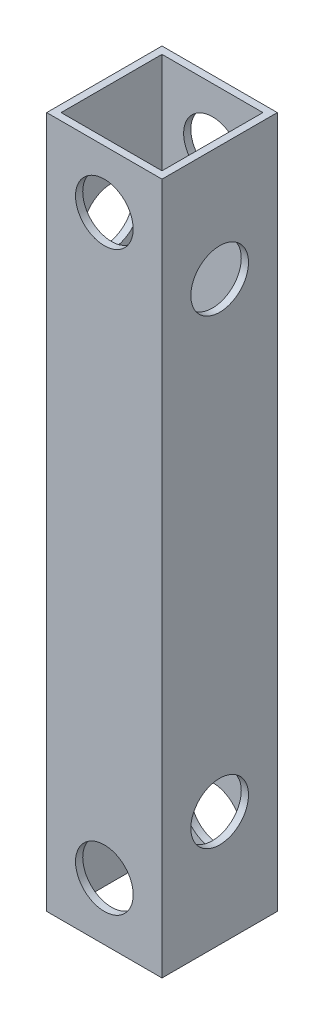
from build123d import *

# Parameters (mm, degrees)
SKETCH1_W           = 25.4
SKETCH1_H           = 25.4
SKETCH1_W_2         = 22.225
SKETCH1_H_2         = 22.225
BOSS_EXTRUDE1_DEPTH = 152.4
SKETCH2_R           = 6.35
CUT_EXTRUDE1_DEPTH  = 127
SKETCH3_R           = 6.35
CUT_EXTRUDE2_DEPTH  = 127
SKETCH4_R           = 6.35
CUT_EXTRUDE3_DEPTH  = 127
SKETCH5_R           = 6.35
CUT_EXTRUDE4_DEPTH  = 127


with BuildPart() as part:
    # Sketch1 → Boss-Extrude1 (new body)
    with BuildSketch(Plane(origin=(0, 0, 0), x_dir=(1, 0, 0), z_dir=(0, 1, 0))):
        Rectangle(SKETCH1_W, SKETCH1_H)
        Rectangle(SKETCH1_W_2, SKETCH1_H_2, mode=Mode.SUBTRACT)
    extrude(amount=BOSS_EXTRUDE1_DEPTH)

    # Sketch2 → Cut-Extrude1 (cut)
    with BuildSketch(Plane(origin=(0, 0, -12.7), x_dir=(-1, 0, 0), z_dir=(0, 0, -1))):
        with Locations((0, 139.7)):
            Circle(SKETCH2_R)
    extrude(amount=-CUT_EXTRUDE1_DEPTH, mode=Mode.SUBTRACT)

    # Sketch3 → Cut-Extrude2 (cut)
    with BuildSketch(Plane(origin=(12.7, 0, 0), x_dir=(0, 0, -1), z_dir=(1, 0, 0))):
        with Locations((0, 127)):
            Circle(SKETCH3_R)
    extrude(amount=-CUT_EXTRUDE2_DEPTH, mode=Mode.SUBTRACT)

    # Sketch4 → Cut-Extrude3 (cut)
    with BuildSketch(Plane(origin=(0, 0, -12.7), x_dir=(-1, 0, 0), z_dir=(0, 0, -1))):
        with Locations((0, 12.7)):
            Circle(SKETCH4_R)
    extrude(amount=-CUT_EXTRUDE3_DEPTH, mode=Mode.SUBTRACT)

    # Sketch5 → Cut-Extrude4 (cut)
    with BuildSketch(Plane(origin=(12.7, 0, 0), x_dir=(0, 0, -1), z_dir=(1, 0, 0))):
        with Locations((0, 25.4)):
            Circle(SKETCH5_R)
    extrude(amount=-CUT_EXTRUDE4_DEPTH, mode=Mode.SUBTRACT)


solid = part.part
